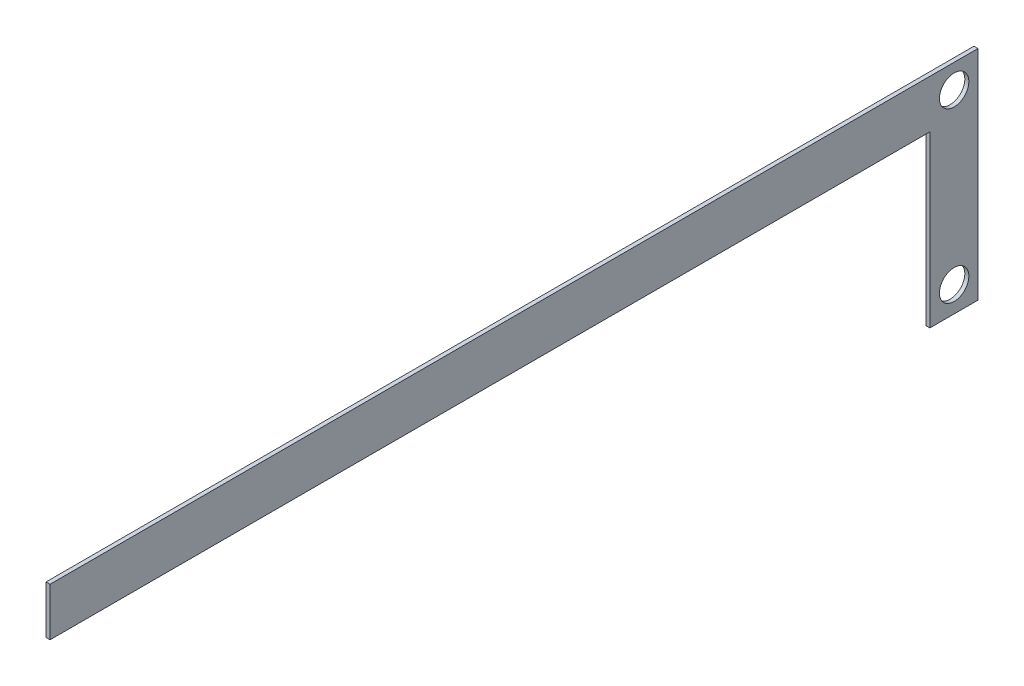
from build123d import *

# Parameters (mm, degrees)
BOSS_EXTRUDE1_DEPTH = 0.3
SKETCH3_R           = 1.1
CUT_EXTRUDE5_DEPTH  = 0.3


with BuildPart() as part:
    # Sketch2 → Boss-Extrude1 (new body)
    with BuildSketch(Plane(origin=(0, 0, 0), x_dir=(0, 0, -1), z_dir=(1, 0, 0))):
        Polygon((0, 0), (0, 3.6), (69.4, 3.6), (69.4, -12.7), (65.8, -12.7), (65.8, 0), align=None)
    extrude(amount=BOSS_EXTRUDE1_DEPTH)

    # Sketch3 → Cut-Extrude5 (cut)
    with BuildSketch(Plane(origin=(0.3, 0, 0), x_dir=(0, 0, -1), z_dir=(1, 0, 0))):
        with Locations((67.6145, 1.805)):
            Circle(SKETCH3_R)
        with Locations((67.6145, -10.795)):
            Circle(SKETCH3_R)
    extrude(amount=-CUT_EXTRUDE5_DEPTH, mode=Mode.SUBTRACT)


solid = part.part
